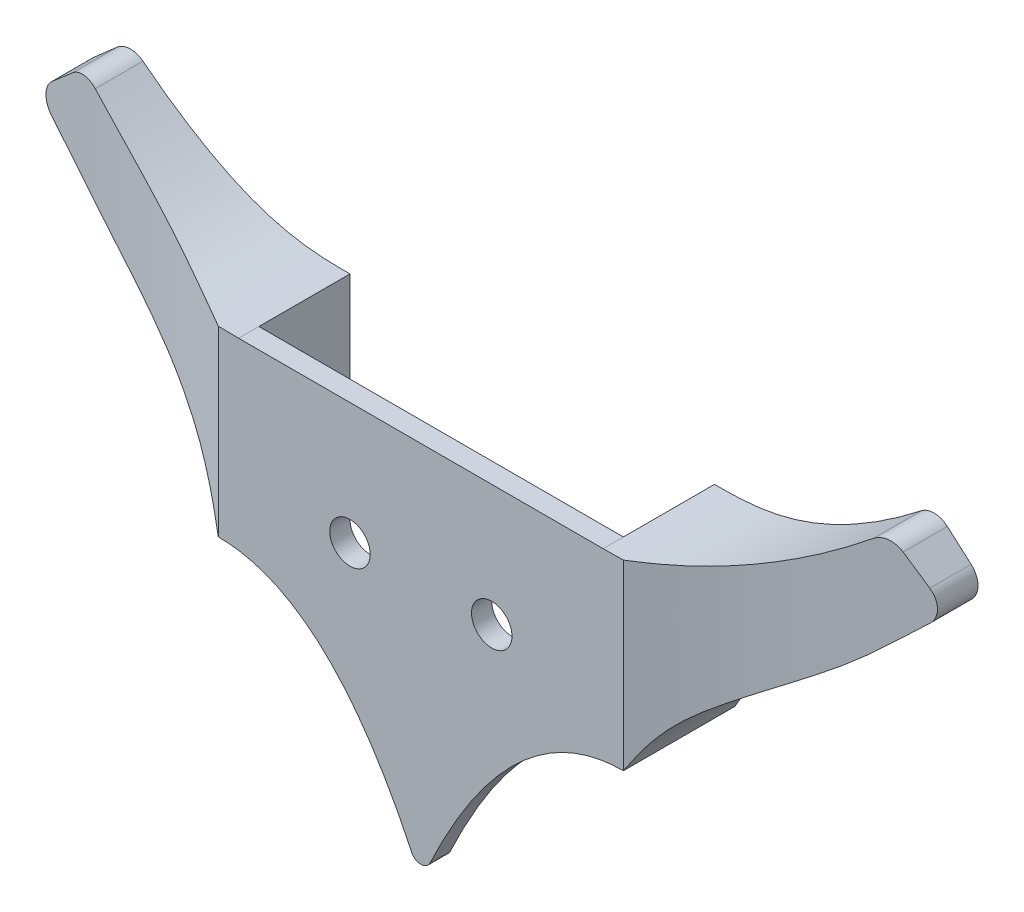
from build123d import *

# Parameters (mm, degrees)
MAIN_DEPTH         = 11
FILLET1_R          = 2
SKETCH2_W          = 18
SKETCH2_H          = 36
CUT_EXTRUDE1_DEPTH = 9
CUT_EXTRUDE3_DEPTH = 64.480897399
SKETCH5_R          = 2
CUT_EXTRUDE4_DEPTH = 51.650082667


with BuildPart() as part:
    # Sketch1 → Main (new body)
    with BuildSketch(Plane.XY):
        with BuildLine():
            Line((0, 13.5), (0, -22.5))
            ThreePointArc((0, -22.5), (0.535266132, -22.344683472), (0.904260909, -21.926980336))
            add(Edge.make_bspline(
                [(0.904260909, -21.926980336), (9.133056217, -4.5), (20, -4.5)],
                knots=[0, 0, 0, 1, 1, 1], degree=2))
            add(Edge.make_bspline(
                [(20, -4.5), (22.442131921, -0.087784975), (24.417478165, 1.364672535), (37.311838004, 10.291321925), (39.092642364, 12.366823321), (45, 17.882159487)],
                knots=[0, 0, 0, 0, 0.423319092, 0.523319092, 1, 1, 1, 1], degree=3))
            Line((45, 17.882159487), (39.739244446, 22.5))
            add(Edge.make_bspline(
                [(18, 13.5), (22.59390453, 13.5), (28.738216645, 13.511797359), (39.739244446, 22.5)],
                knots=[0, 0, 0, 0, 1, 1, 1, 1], degree=3))
            Line((18, 13.5), (0, 13.5))
        make_face()
    extrude(amount=MAIN_DEPTH)

    # Fillet1
    fillet1_edges = [part.edges().sort_by_distance(p)[0] for p in [
        (45, 17.882159487, 5.5),
        (39.739244446, 22.5, 5.5),
    ]]
    fillet(fillet1_edges, radius=FILLET1_R)

    # Sketch2 → Cut-Extrude1 (cut)
    with BuildSketch(Plane(origin=(0, 0, 0), x_dir=(-1, 0, 0), z_dir=(0, 0, -1))):
        with Locations((-9, -4.5)):
            Rectangle(SKETCH2_W, SKETCH2_H)
    extrude(amount=-CUT_EXTRUDE1_DEPTH, mode=Mode.SUBTRACT)

    # Sketch4 → Cut-Extrude3 (cut, through all)
    with BuildSketch(Plane(origin=(0, -22.5, 0), x_dir=(1, 0, 0), z_dir=(0, 1, 0))):
        with BuildLine():
            Line((20, -11), (44.024775506, -11))
            Line((44.024775506, -11), (44.024775506, -4))
            add(Edge.make_bspline(
                [(20, -11), (28.635170746, -6.13298307), (33.086101869, -5.284313506), (44.024775506, -4)],
                knots=[0, 0, 0, 0, 1, 1, 1, 1], degree=3))
        make_face()
    extrude(amount=CUT_EXTRUDE3_DEPTH, mode=Mode.SUBTRACT)

    # Sketch5 → Cut-Extrude4 (cut, through all)
    with BuildSketch(Plane.XY.offset(11)):
        with Locations((7, 1.5)):
            Circle(SKETCH5_R)
    extrude(amount=-CUT_EXTRUDE4_DEPTH, mode=Mode.SUBTRACT)

    # Mirror1: part across plane


with BuildPart() as part_1:
    add(part.part)
    add(part.part.mirror(Plane(origin=(0, 13.5, 11), x_dir=(0, 0, 1), z_dir=(1, 0, 0))))


solid = part_1.part
